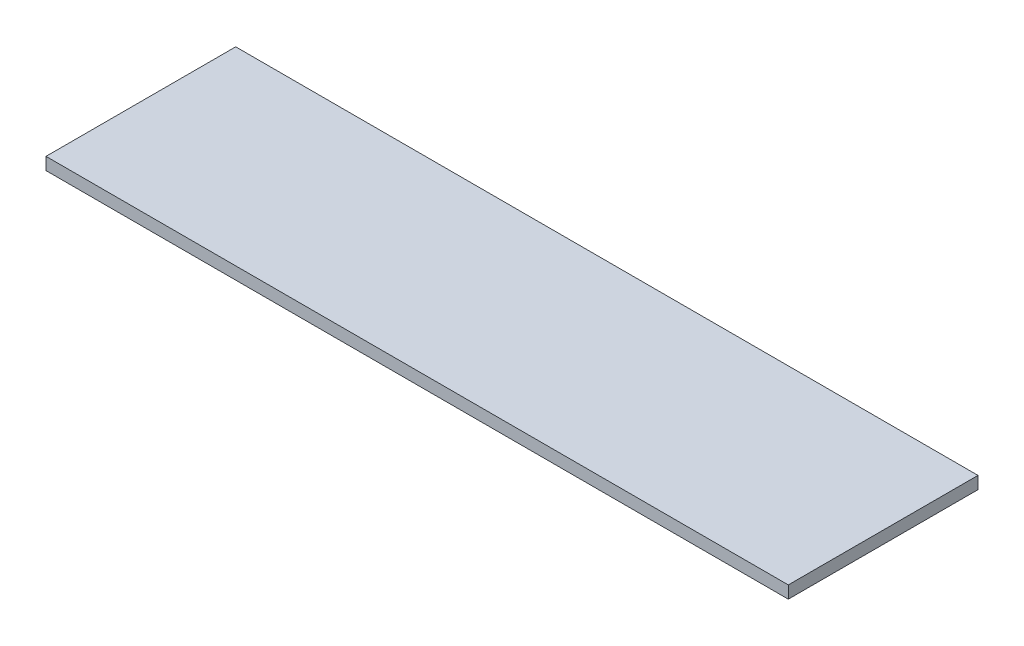
from build123d import *

# Parameters (mm, degrees)
SKETCH_1_W      = 180
SKETCH_1_H      = 46
EXTRUDE_1_DEPTH = 1.5


with BuildPart() as part:
    # ｽｹｯﾁ1 → ﾎﾞｽ - 押し出し1 (new, symmetric)
    with BuildSketch(Plane(origin=(0, 0, 0), x_dir=(1, 0, 0), z_dir=(0, 1, 0))):
        with Locations((10, 0)):
            Rectangle(SKETCH_1_W, SKETCH_1_H)
    extrude(amount=EXTRUDE_1_DEPTH, both=True)


solid = part.part
